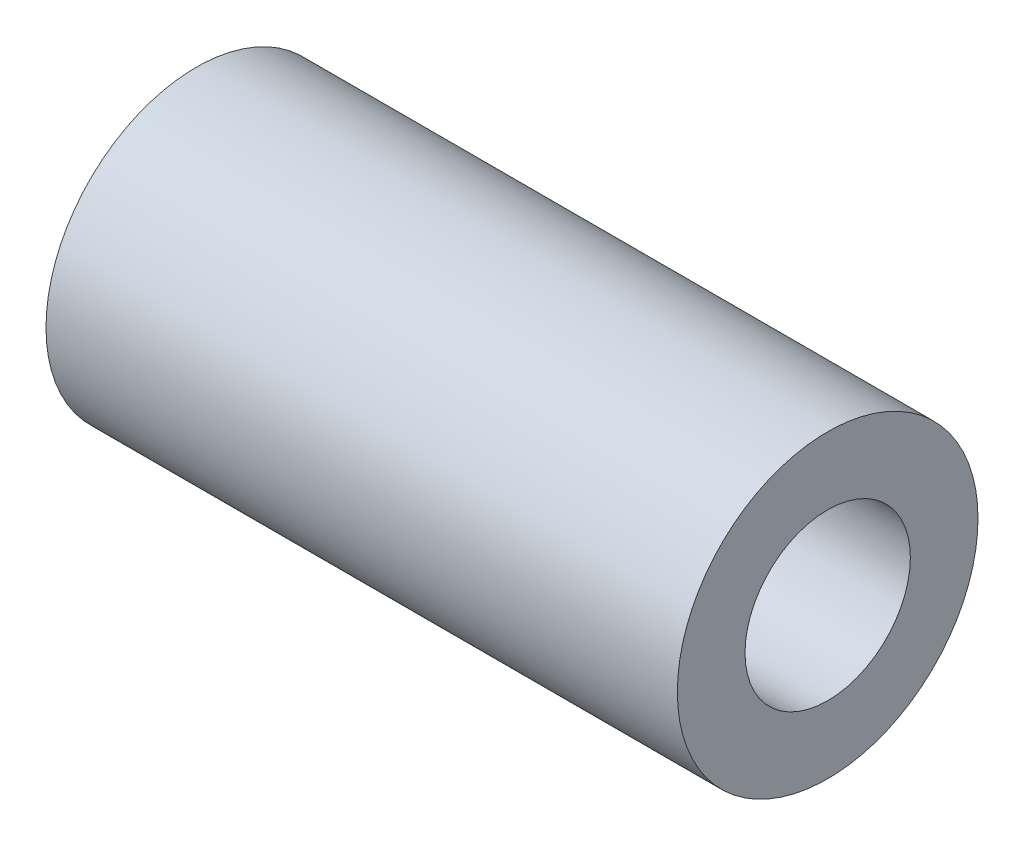
from build123d import *

# Parameters (mm, degrees)
SKETCH1_R           = 5
SKETCH1_R_2         = 2.75
BOSS_EXTRUDE1_DEPTH = 21


with BuildPart() as part:
    # Sketch1 → Boss-Extrude1 (new body)
    with BuildSketch(Plane(origin=(0, 0, 0), x_dir=(0, 0, -1), z_dir=(1, 0, 0))):
        with Locations(Location((0, 0, 0), (0, 0, 180))):
            Circle(SKETCH1_R)
        with Locations(Location((0, 0, 0), (0, 0, 180))):
            Circle(SKETCH1_R_2, mode=Mode.SUBTRACT)
    extrude(amount=BOSS_EXTRUDE1_DEPTH)


solid = part.part
